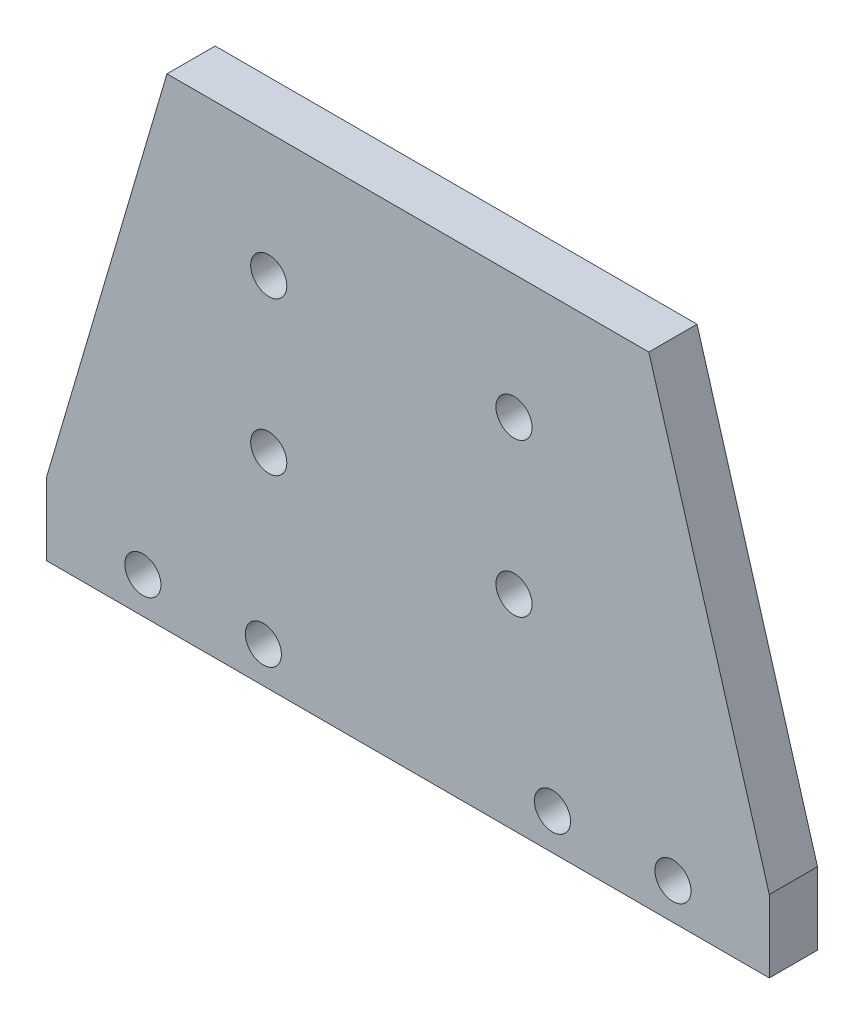
from build123d import *

# Parameters (mm, degrees)
SKETCH_1_W               = 60
SKETCH_1_H               = 40
EXTRUDE_1_DEPTH          = 4
CUT_EXTRUDE_1_DEPTH      = 37.276714294
CUT_EXTRUDE_1_DEPTH_BACK = 4
SKETCH_4_R               = 1.5
CUT_EXTRUDE_2_DEPTH      = 10
SKETCH_5_R               = 1.5
CUT_EXTRUDE_3_DEPTH      = 23


with BuildPart() as part:
    # 草图1 → 凸台-拉伸1 (new body)
    with BuildSketch(Plane.XY):
        Rectangle(SKETCH_1_W, SKETCH_1_H)
    extrude(amount=EXTRUDE_1_DEPTH)

    # 草图3 → 切除-拉伸1 (cut, two sides: drawn at the far end of the back side and taken through both)
    with BuildSketch(Plane.XY.offset(4).offset(-CUT_EXTRUDE_1_DEPTH_BACK)):
        Polygon((-30, -14), (-20, 20), (-34.139231405, 23.424173554), (-38.463694215, 14.486950413), (-35.628768595, 5.021181818), (-34.139231405, -14), align=None)
        Polygon((35.628768595, 5.021181818), (34.139231405, -14), (30, -14), (20, 20), (34.139231405, 23.424173554), (38.463694215, 14.486950413), align=None)
    extrude(amount=CUT_EXTRUDE_1_DEPTH + CUT_EXTRUDE_1_DEPTH_BACK, mode=Mode.SUBTRACT)

    # 草图4 → 切除-拉伸2 (cut)
    with BuildSketch(Plane(origin=(0, 0, 0), x_dir=(-1, 0, 0), z_dir=(0, 0, -1))):
        with Locations((22, -17)):
            Circle(SKETCH_4_R)
        with Locations((12, -17)):
            Circle(SKETCH_4_R)
        with Locations((-12, -17)):
            Circle(SKETCH_4_R)
        with Locations((-22, -17)):
            Circle(SKETCH_4_R)
    extrude(amount=-CUT_EXTRUDE_2_DEPTH, mode=Mode.SUBTRACT)

    # 草图5 → 切除-拉伸3 (cut)
    with BuildSketch(Plane.XY.offset(4)):
        with Locations((-11.552312048, -2.99728939)):
            Circle(SKETCH_5_R)
        with Locations((-11.552312048, 9.716256449)):
            Circle(SKETCH_5_R)
        with Locations((8.807786724, -2.99728939)):
            Circle(SKETCH_5_R)
        with Locations((8.807786724, 9.716256449)):
            Circle(SKETCH_5_R)
    extrude(amount=-CUT_EXTRUDE_3_DEPTH, mode=Mode.SUBTRACT)


solid = part.part
